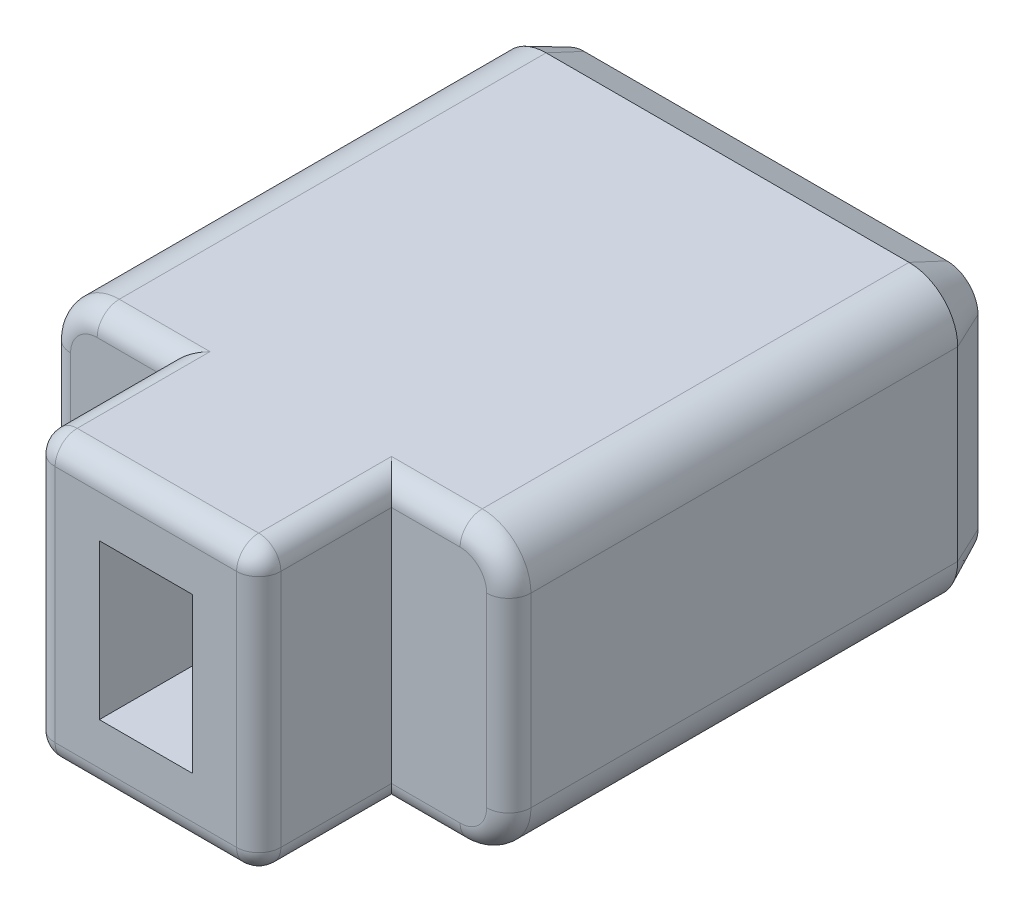
from build123d import *

# Parameters (mm, degrees)
BOSS_EXTRU_1_DEPTH      = 14
ESQUISSE3_W             = 2.1
ESQUISSE3_H             = 3.5
ENL_V_MAT_EXTRU_1_DEPTH = 3
ESQUISSE4_OUTSIDE_W     = 16.116
ESQUISSE4_OUTSIDE_H     = 12.116
ESQUISSE4_OUTSIDE_W_2   = 5.1
ESQUISSE4_OUTSIDE_H_2   = 6.4
ENL_V_MAT_EXTRU_2_DEPTH = 3
CONG_1_R                = 0.5
CHANFREIN1_SIZE         = 0.4
CHANFREIN1_SIZE2        = 0.857802768
ENL_V_MAT_EXTRU_3_DEPTH = 0.3
BOSS_EXTRU_2_DEPTH      = 0.3


with BuildPart() as part:
    # Esquisse2 → Boss.-Extru.1 (new body)
    with BuildSketch(Plane.XY):
        with BuildLine():
            Line((1.1, 0), (9.3, 0))
            ThreePointArc((9.3, 0), (10.077817459, 0.322182541), (10.4, 1.1))
            Line((10.4, 1.1), (10.4, 5.3))
            ThreePointArc((10.4, 5.3), (10.077817459, 6.077817459), (9.3, 6.4))
            Line((9.3, 6.4), (1.1, 6.4))
            ThreePointArc((1.1, 6.4), (0.322182541, 6.077817459), (0, 5.3))
            Line((0, 5.3), (0, 1.1))
            ThreePointArc((0, 1.1), (0.322182541, 0.322182541), (1.1, 0))
        make_face()
    extrude(amount=BOSS_EXTRU_1_DEPTH)

    # Esquisse3 → Enlèv. mat.-Extru.1 (cut)
    with BuildSketch(Plane.XY.offset(14)):
        with Locations((5.2, 3.2)):
            Rectangle(ESQUISSE3_W, ESQUISSE3_H)
    extrude(amount=-ENL_V_MAT_EXTRU_1_DEPTH, mode=Mode.SUBTRACT)

    # Esquisse4 outside → Enlèv. mat.-Extru.2 (cut)
    with BuildSketch(Plane.XY.offset(14)):
        with Locations((5.2, 3.2)):
            Rectangle(ESQUISSE4_OUTSIDE_W, ESQUISSE4_OUTSIDE_H)
        with Locations((5.2, 3.2)):
            Rectangle(ESQUISSE4_OUTSIDE_W_2, ESQUISSE4_OUTSIDE_H_2, mode=Mode.SUBTRACT)
    extrude(amount=-ENL_V_MAT_EXTRU_2_DEPTH, mode=Mode.SUBTRACT)

    # Congé1
    cong_1_edges = [part.edges().sort_by_distance(p)[0] for p in [
        (8.525, 0, 11),
        (10.077817459, 0.322182541, 11),
        (10.4, 3.2, 11),
        (10.077817459, 6.077817459, 11),
        (1.875, 6.4, 11),
        (0.322182541, 6.077817459, 11),
        (1.875, 0, 11),
        (0.322182541, 0.322182541, 11),
        (7.75, 6.4, 12.5),
        (2.65, 6.4, 12.5),
        (7.75, 0, 12.5),
        (2.65, 0, 12.5),
        (2.65, 3.2, 14),
        (5.2, 6.4, 14),
        (7.75, 3.2, 14),
        (5.2, 0, 14),
        (8.525, 6.4, 11),
        (0, 3.2, 11),
    ]]
    fillet(cong_1_edges, radius=CONG_1_R)

    # Chanfrein1
    chanfrein1_edges = [part.edges().sort_by_distance(p)[0] for p in [
        (5.2, 0, 0),
        (10.077817459, 0.322182541, 0),
        (0.322182541, 0.322182541, 0),
        (10.4, 3.2, 0),
        (0, 3.2, 0),
        (10.077817459, 6.077817459, 0),
        (0.322182541, 6.077817459, 0),
        (5.2, 6.4, 0),
    ]]
    chanfrein1_side = [part.faces().sort_by_distance(p)[0] for p in [
        (5.2, 3.2, 0),
    ]]
    chamfer(chanfrein1_edges, length=CHANFREIN1_SIZE, length2=CHANFREIN1_SIZE2, reference=chanfrein1_side[0])

    # Esquisse5 → Enlèv. mat.-Extru.3 (cut)
    with BuildSketch(Plane(origin=(0, 0, 0), x_dir=(-1, 0, 0), z_dir=(0, 0, -1))):
        with BuildLine():
            Line((-4.482051282, 2.223076923), (-4.123076923, 2.223076923))
            add(Edge.make_bspline(
                [(-4.123076923, 2.223076923), (-4.132172802, 2.182879821), (-4.149904355, 2.104519386), (-4.184689712, 1.991513998), (-4.225434495, 1.885765982), (-4.271957447, 1.78691387), (-4.323886866, 1.694871968), (-4.383007257, 1.610659662), (-4.446581457, 1.532228116), (-4.517727797, 1.463096907), (-4.591770568, 1.39996683), (-4.670710111, 1.346640876), (-4.752169587, 1.300230117), (-4.83719503, 1.262457843), (-4.925900563, 1.233638239), (-5.017876741, 1.21280939), (-5.113071631, 1.199496847), (-5.177787354, 1.198126712), (-5.210416667, 1.197435897)],
                knots=[0, 0, 0, 0, 1.213646873, 2.365889363, 3.479226314, 4.54912843, 5.581579656, 6.587705624, 7.576924878, 8.55050232, 9.505464024, 10.439453725, 11.351887816, 12.264152294, 13.174752891, 14.094686289, 15.039351257, 16, 16, 16, 16], degree=3))
            add(Edge.make_bspline(
                [(-5.210416667, 1.197435897), (-5.258094164, 1.199027149), (-5.352644116, 1.202182785), (-5.491403374, 1.230611249), (-5.625136021, 1.275963762), (-5.7524842, 1.338183678), (-5.870766075, 1.415281732), (-5.976128691, 1.506523979), (-6.066425025, 1.611076421), (-6.142330911, 1.726114044), (-6.202133725, 1.848818877), (-6.244814609, 1.975692907), (-6.271762849, 2.105224606), (-6.275198805, 2.192767116), (-6.276923077, 2.236698718)],
                knots=[0, 0, 0, 0, 1.037361841, 2.057207614, 3.07074694, 4.106133614, 5.135440569, 6.137362823, 7.131079132, 8.134553603, 9.130922184, 10.094788979, 11.043904817, 12, 12, 12, 12], degree=3))
            add(Edge.make_bspline(
                [(-6.276923077, 2.236698718), (-6.275539605, 2.278987452), (-6.272833897, 2.361693152), (-6.251540773, 2.482378728), (-6.216237816, 2.596400166), (-6.166137783, 2.703538574), (-6.102114735, 2.804087582), (-6.023690642, 2.897152494), (-5.931612715, 2.984047443), (-5.86169914, 3.033978011), (-5.825801282, 3.059615385)],
                knots=[0, 0, 0, 0, 1.034740432, 2.023681557, 2.989439786, 3.948891607, 4.910213012, 5.898894732, 6.921165452, 8, 8, 8, 8], degree=3))
            add(Edge.make_bspline(
                [(-5.825801282, 3.059615385), (-5.864137499, 3.080191012), (-5.940809934, 3.121342266), (-6.043507734, 3.202018162), (-6.138023166, 3.293734818), (-6.189768342, 3.364866735), (-6.216025641, 3.400961538)],
                knots=[0, 0, 0, 0, 0.994607769, 1.989215539, 2.979658163, 4, 4, 4, 4], degree=3))
            add(Edge.make_bspline(
                [(-6.216025641, 3.400961538), (-6.233356316, 3.427373686), (-6.26787002, 3.479972967), (-6.310391281, 3.563667495), (-6.347879736, 3.649096513), (-6.37822649, 3.736968961), (-6.401497955, 3.827322661), (-6.418276255, 3.919969224), (-6.429147626, 4.015018145), (-6.430226667, 4.079350901), (-6.430769231, 4.111698718)],
                knots=[0, 0, 0, 0, 1.00515716, 2.001751025, 2.984458985, 3.97420733, 4.958128942, 5.952324961, 6.970387383, 8, 8, 8, 8], degree=3))
            add(Edge.make_bspline(
                [(-6.430769231, 4.111698718), (-6.428743989, 4.167663613), (-6.42471183, 4.279086982), (-6.392790373, 4.444008829), (-6.342381333, 4.604955427), (-6.27195412, 4.75956667), (-6.18482671, 4.904129083), (-6.081145827, 5.033094403), (-5.962534477, 5.144582643), (-5.830197653, 5.237360691), (-5.68630887, 5.311534147), (-5.532868345, 5.364666879), (-5.370679404, 5.396859709), (-5.259709965, 5.400639474), (-5.203205128, 5.402564103)],
                knots=[0, 0, 0, 0, 1.014706638, 2.020231274, 3.036313833, 4.068571099, 5.094908553, 6.090824756, 7.060992088, 8.038345228, 9.013581893, 9.988228495, 10.975620497, 12, 12, 12, 12], degree=3))
            add(Edge.make_bspline(
                [(-5.203205128, 5.402564103), (-5.165246363, 5.401570424), (-5.090682463, 5.399618502), (-4.9810235, 5.386317129), (-4.876778256, 5.361480703), (-4.776379933, 5.330186609), (-4.681760311, 5.286956208), (-4.591303684, 5.235671401), (-4.506016772, 5.174294586), (-4.425884157, 5.103608562), (-4.351166433, 5.024051615), (-4.282737635, 4.935670934), (-4.222178503, 4.838072885), (-4.166983575, 4.732595618), (-4.120271063, 4.617488155), (-4.079407489, 4.494143595), (-4.045544141, 4.361842187), (-4.029014069, 4.270204999), (-4.020512821, 4.223076923)],
                knots=[0, 0, 0, 0, 0.990568784, 1.945813299, 2.875676271, 3.783761552, 4.685324092, 5.584377753, 6.493425385, 7.4218245, 8.36851308, 9.337390209, 10.333265409, 11.361963029, 12.440115797, 13.570763079, 14.750668092, 16, 16, 16, 16], degree=3))
            Line((-4.020512821, 4.223076923), (-4.379487179, 4.223076923))
            add(Edge.make_bspline(
                [(-4.379487179, 4.223076923), (-4.387118243, 4.253901726), (-4.401958094, 4.313845598), (-4.429866947, 4.399311139), (-4.45787412, 4.47900565), (-4.490311856, 4.551314604), (-4.524644529, 4.617265759), (-4.561464259, 4.677017538), (-4.601146872, 4.729940781), (-4.630535719, 4.760986514), (-4.644711538, 4.775961538)],
                knots=[0, 0, 0, 0, 1.227409514, 2.386898646, 3.474821375, 4.49196229, 5.448190758, 6.348047463, 7.203174547, 8, 8, 8, 8], degree=3))
            add(Edge.make_bspline(
                [(-4.644711538, 4.775961538), (-4.663625825, 4.793169329), (-4.701087137, 4.827250782), (-4.76262788, 4.8714789), (-4.82763193, 4.909502151), (-4.896789588, 4.939903316), (-4.969627615, 4.963233834), (-5.046089988, 4.979888915), (-5.126502917, 4.990788894), (-5.18153399, 4.991794533), (-5.209615385, 4.992307692)],
                knots=[0, 0, 0, 0, 0.987673777, 1.956169713, 2.922958465, 3.893597884, 4.869766497, 5.874185781, 6.915234169, 8, 8, 8, 8], degree=3))
            add(Edge.make_bspline(
                [(-5.209615385, 4.992307692), (-5.241448955, 4.991621354), (-5.303484394, 4.990283856), (-5.39400022, 4.977425049), (-5.480036376, 4.959232218), (-5.560686962, 4.930153903), (-5.637551649, 4.895417149), (-5.708737853, 4.850964488), (-5.775216799, 4.799002976), (-5.836422077, 4.74018012), (-5.89108324, 4.675557144), (-5.939388385, 4.608069597), (-5.980982451, 4.538169232), (-6.013333239, 4.464646611), (-6.040538243, 4.389136122), (-6.058770549, 4.310341705), (-6.069136276, 4.228963731), (-6.070902137, 4.173960727), (-6.071794872, 4.146153846)],
                knots=[0, 0, 0, 0, 1.131388683, 2.204785482, 3.246441662, 4.252851856, 5.247356788, 6.241181003, 7.22926868, 8.243715995, 9.254465245, 10.235036049, 11.192984918, 12.141087045, 13.087426855, 14.043631555, 15.010953923, 16, 16, 16, 16], degree=3))
            add(Edge.make_bspline(
                [(-6.071794872, 4.146153846), (-6.070425424, 4.108923192), (-6.06770243, 4.034894228), (-6.045263849, 3.925951777), (-6.008784671, 3.820693552), (-5.958785101, 3.720677931), (-5.896401591, 3.62841055), (-5.823392741, 3.547133882), (-5.740422622, 3.477841607), (-5.662765755, 3.43054886), (-5.593787365, 3.398821262), (-5.535204528, 3.377096108), (-5.469607981, 3.359132482), (-5.398017693, 3.342329942), (-5.319417432, 3.327809305), (-5.234365734, 3.316175248), (-5.142449502, 3.306375708), (-5.079025259, 3.302176407), (-5.046153846, 3.3)],
                knots=[0, 0, 0, 0, 1.192805178, 2.371758753, 3.549810072, 4.756155874, 5.946098869, 7.110280517, 8.247279574, 9.400162675, 10.013208869, 10.679725361, 11.400782005, 12.192190353, 13.037020936, 13.96226458, 14.943885823, 16, 16, 16, 16], degree=3))
            Line((-5.046153846, 3.3), (-5.046153846, 2.88974359))
            add(Edge.make_bspline(
                [(-5.046153846, 2.88974359), (-5.088150562, 2.888762199), (-5.170660543, 2.886834082), (-5.291308641, 2.868815079), (-5.406306817, 2.839057635), (-5.513901263, 2.797793619), (-5.611837507, 2.748050326), (-5.697356677, 2.691251666), (-5.767743193, 2.626744832), (-5.823945861, 2.556359146), (-5.865824484, 2.480980159), (-5.89566742, 2.40214926), (-5.91522079, 2.319915292), (-5.917034619, 2.263518126), (-5.917948718, 2.235096154)],
                knots=[0, 0, 0, 0, 1.243616131, 2.44330398, 3.604505843, 4.75669394, 5.850271017, 6.853290421, 7.788562808, 8.667255455, 9.510416964, 10.331949075, 11.159367386, 12, 12, 12, 12], degree=3))
            add(Edge.make_bspline(
                [(-5.917948718, 2.235096154), (-5.91735912, 2.214221522), (-5.916188689, 2.172782552), (-5.906034732, 2.111908452), (-5.891099605, 2.052952656), (-5.869264862, 1.996484401), (-5.840766114, 1.942387341), (-5.80637209, 1.890106875), (-5.764855489, 1.840569584), (-5.7192227, 1.792655284), (-5.667906556, 1.74940941), (-5.612600183, 1.712031857), (-5.554359317, 1.679379127), (-5.492850933, 1.6530839), (-5.42784051, 1.632866221), (-5.359681028, 1.618661468), (-5.288113774, 1.609612794), (-5.239290185, 1.608340381), (-5.214423077, 1.607692308)],
                knots=[0, 0, 0, 0, 0.95422432, 1.894264499, 2.815862866, 3.732507896, 4.656047834, 5.60823639, 6.589073805, 7.608638867, 8.631711616, 9.651715799, 10.65801814, 11.681528505, 12.705549186, 13.767074307, 14.862713597, 16, 16, 16, 16], degree=3))
            add(Edge.make_bspline(
                [(-5.214423077, 1.607692308), (-5.174463142, 1.609275267), (-5.096292971, 1.612371873), (-4.983725649, 1.639891651), (-4.879168109, 1.683156126), (-4.800266567, 1.735429254), (-4.742005947, 1.786360527), (-4.699530846, 1.830715578), (-4.658184177, 1.880805783), (-4.619294171, 1.937517388), (-4.582737756, 2.0006376), (-4.546195196, 2.068600834), (-4.512748799, 2.143503144), (-4.492494915, 2.196005048), (-4.482051282, 2.223076923)],
                knots=[0, 0, 0, 0, 1.395667895, 2.730224622, 4.027984045, 5.336391174, 6.018318975, 6.731826814, 7.481767641, 8.28762907, 9.133535766, 10.031970229, 10.985212891, 12, 12, 12, 12], degree=3))
        make_face()
    extrude(amount=-ENL_V_MAT_EXTRU_3_DEPTH, mode=Mode.SUBTRACT)


with BuildPart() as body_2:
    # Esquisse5<2> → Boss.-Extru.2 (new body)
    with BuildSketch(Plane(origin=(0, 0, 0), x_dir=(-1, 0, 0), z_dir=(0, 0, -1))):
        with BuildLine():
            Line((-4.482051282, 2.223076923), (-4.123076923, 2.223076923))
            add(Edge.make_bspline(
                [(-4.123076923, 2.223076923), (-4.132172802, 2.182879821), (-4.149904355, 2.104519386), (-4.184689712, 1.991513998), (-4.225434495, 1.885765982), (-4.271957447, 1.78691387), (-4.323886866, 1.694871968), (-4.383007257, 1.610659662), (-4.446581457, 1.532228116), (-4.517727797, 1.463096907), (-4.591770568, 1.39996683), (-4.670710111, 1.346640876), (-4.752169587, 1.300230117), (-4.83719503, 1.262457843), (-4.925900563, 1.233638239), (-5.017876741, 1.21280939), (-5.113071631, 1.199496847), (-5.177787354, 1.198126712), (-5.210416667, 1.197435897)],
                knots=[0, 0, 0, 0, 1.213646873, 2.365889363, 3.479226314, 4.54912843, 5.581579656, 6.587705624, 7.576924878, 8.55050232, 9.505464024, 10.439453725, 11.351887816, 12.264152294, 13.174752891, 14.094686289, 15.039351257, 16, 16, 16, 16], degree=3))
            add(Edge.make_bspline(
                [(-5.210416667, 1.197435897), (-5.258094164, 1.199027149), (-5.352644116, 1.202182785), (-5.491403374, 1.230611249), (-5.625136021, 1.275963762), (-5.7524842, 1.338183678), (-5.870766075, 1.415281732), (-5.976128691, 1.506523979), (-6.066425025, 1.611076421), (-6.142330911, 1.726114044), (-6.202133725, 1.848818877), (-6.244814609, 1.975692907), (-6.271762849, 2.105224606), (-6.275198805, 2.192767116), (-6.276923077, 2.236698718)],
                knots=[0, 0, 0, 0, 1.037361841, 2.057207614, 3.07074694, 4.106133614, 5.135440569, 6.137362823, 7.131079132, 8.134553603, 9.130922184, 10.094788979, 11.043904817, 12, 12, 12, 12], degree=3))
            add(Edge.make_bspline(
                [(-6.276923077, 2.236698718), (-6.275539605, 2.278987452), (-6.272833897, 2.361693152), (-6.251540773, 2.482378728), (-6.216237816, 2.596400166), (-6.166137783, 2.703538574), (-6.102114735, 2.804087582), (-6.023690642, 2.897152494), (-5.931612715, 2.984047443), (-5.86169914, 3.033978011), (-5.825801282, 3.059615385)],
                knots=[0, 0, 0, 0, 1.034740432, 2.023681557, 2.989439786, 3.948891607, 4.910213012, 5.898894732, 6.921165452, 8, 8, 8, 8], degree=3))
            add(Edge.make_bspline(
                [(-5.825801282, 3.059615385), (-5.864137499, 3.080191012), (-5.940809934, 3.121342266), (-6.043507734, 3.202018162), (-6.138023166, 3.293734818), (-6.189768342, 3.364866735), (-6.216025641, 3.400961538)],
                knots=[0, 0, 0, 0, 0.994607769, 1.989215539, 2.979658163, 4, 4, 4, 4], degree=3))
            add(Edge.make_bspline(
                [(-6.216025641, 3.400961538), (-6.233356316, 3.427373686), (-6.26787002, 3.479972967), (-6.310391281, 3.563667495), (-6.347879736, 3.649096513), (-6.37822649, 3.736968961), (-6.401497955, 3.827322661), (-6.418276255, 3.919969224), (-6.429147626, 4.015018145), (-6.430226667, 4.079350901), (-6.430769231, 4.111698718)],
                knots=[0, 0, 0, 0, 1.00515716, 2.001751025, 2.984458985, 3.97420733, 4.958128942, 5.952324961, 6.970387383, 8, 8, 8, 8], degree=3))
            add(Edge.make_bspline(
                [(-6.430769231, 4.111698718), (-6.428743989, 4.167663613), (-6.42471183, 4.279086982), (-6.392790373, 4.444008829), (-6.342381333, 4.604955427), (-6.27195412, 4.75956667), (-6.18482671, 4.904129083), (-6.081145827, 5.033094403), (-5.962534477, 5.144582643), (-5.830197653, 5.237360691), (-5.68630887, 5.311534147), (-5.532868345, 5.364666879), (-5.370679404, 5.396859709), (-5.259709965, 5.400639474), (-5.203205128, 5.402564103)],
                knots=[0, 0, 0, 0, 1.014706638, 2.020231274, 3.036313833, 4.068571099, 5.094908553, 6.090824756, 7.060992088, 8.038345228, 9.013581893, 9.988228495, 10.975620497, 12, 12, 12, 12], degree=3))
            add(Edge.make_bspline(
                [(-5.203205128, 5.402564103), (-5.165246363, 5.401570424), (-5.090682463, 5.399618502), (-4.9810235, 5.386317129), (-4.876778256, 5.361480703), (-4.776379933, 5.330186609), (-4.681760311, 5.286956208), (-4.591303684, 5.235671401), (-4.506016772, 5.174294586), (-4.425884157, 5.103608562), (-4.351166433, 5.024051615), (-4.282737635, 4.935670934), (-4.222178503, 4.838072885), (-4.166983575, 4.732595618), (-4.120271063, 4.617488155), (-4.079407489, 4.494143595), (-4.045544141, 4.361842187), (-4.029014069, 4.270204999), (-4.020512821, 4.223076923)],
                knots=[0, 0, 0, 0, 0.990568784, 1.945813299, 2.875676271, 3.783761552, 4.685324092, 5.584377753, 6.493425385, 7.4218245, 8.36851308, 9.337390209, 10.333265409, 11.361963029, 12.440115797, 13.570763079, 14.750668092, 16, 16, 16, 16], degree=3))
            Line((-4.020512821, 4.223076923), (-4.379487179, 4.223076923))
            add(Edge.make_bspline(
                [(-4.379487179, 4.223076923), (-4.387118243, 4.253901726), (-4.401958094, 4.313845598), (-4.429866947, 4.399311139), (-4.45787412, 4.47900565), (-4.490311856, 4.551314604), (-4.524644529, 4.617265759), (-4.561464259, 4.677017538), (-4.601146872, 4.729940781), (-4.630535719, 4.760986514), (-4.644711538, 4.775961538)],
                knots=[0, 0, 0, 0, 1.227409514, 2.386898646, 3.474821375, 4.49196229, 5.448190758, 6.348047463, 7.203174547, 8, 8, 8, 8], degree=3))
            add(Edge.make_bspline(
                [(-4.644711538, 4.775961538), (-4.663625825, 4.793169329), (-4.701087137, 4.827250782), (-4.76262788, 4.8714789), (-4.82763193, 4.909502151), (-4.896789588, 4.939903316), (-4.969627615, 4.963233834), (-5.046089988, 4.979888915), (-5.126502917, 4.990788894), (-5.18153399, 4.991794533), (-5.209615385, 4.992307692)],
                knots=[0, 0, 0, 0, 0.987673777, 1.956169713, 2.922958465, 3.893597884, 4.869766497, 5.874185781, 6.915234169, 8, 8, 8, 8], degree=3))
            add(Edge.make_bspline(
                [(-5.209615385, 4.992307692), (-5.241448955, 4.991621354), (-5.303484394, 4.990283856), (-5.39400022, 4.977425049), (-5.480036376, 4.959232218), (-5.560686962, 4.930153903), (-5.637551649, 4.895417149), (-5.708737853, 4.850964488), (-5.775216799, 4.799002976), (-5.836422077, 4.74018012), (-5.89108324, 4.675557144), (-5.939388385, 4.608069597), (-5.980982451, 4.538169232), (-6.013333239, 4.464646611), (-6.040538243, 4.389136122), (-6.058770549, 4.310341705), (-6.069136276, 4.228963731), (-6.070902137, 4.173960727), (-6.071794872, 4.146153846)],
                knots=[0, 0, 0, 0, 1.131388683, 2.204785482, 3.246441662, 4.252851856, 5.247356788, 6.241181003, 7.22926868, 8.243715995, 9.254465245, 10.235036049, 11.192984918, 12.141087045, 13.087426855, 14.043631555, 15.010953923, 16, 16, 16, 16], degree=3))
            add(Edge.make_bspline(
                [(-6.071794872, 4.146153846), (-6.070425424, 4.108923192), (-6.06770243, 4.034894228), (-6.045263849, 3.925951777), (-6.008784671, 3.820693552), (-5.958785101, 3.720677931), (-5.896401591, 3.62841055), (-5.823392741, 3.547133882), (-5.740422622, 3.477841607), (-5.662765755, 3.43054886), (-5.593787365, 3.398821262), (-5.535204528, 3.377096108), (-5.469607981, 3.359132482), (-5.398017693, 3.342329942), (-5.319417432, 3.327809305), (-5.234365734, 3.316175248), (-5.142449502, 3.306375708), (-5.079025259, 3.302176407), (-5.046153846, 3.3)],
                knots=[0, 0, 0, 0, 1.192805178, 2.371758753, 3.549810072, 4.756155874, 5.946098869, 7.110280517, 8.247279574, 9.400162675, 10.013208869, 10.679725361, 11.400782005, 12.192190353, 13.037020936, 13.96226458, 14.943885823, 16, 16, 16, 16], degree=3))
            Line((-5.046153846, 3.3), (-5.046153846, 2.88974359))
            add(Edge.make_bspline(
                [(-5.046153846, 2.88974359), (-5.088150562, 2.888762199), (-5.170660543, 2.886834082), (-5.291308641, 2.868815079), (-5.406306817, 2.839057635), (-5.513901263, 2.797793619), (-5.611837507, 2.748050326), (-5.697356677, 2.691251666), (-5.767743193, 2.626744832), (-5.823945861, 2.556359146), (-5.865824484, 2.480980159), (-5.89566742, 2.40214926), (-5.91522079, 2.319915292), (-5.917034619, 2.263518126), (-5.917948718, 2.235096154)],
                knots=[0, 0, 0, 0, 1.243616131, 2.44330398, 3.604505843, 4.75669394, 5.850271017, 6.853290421, 7.788562808, 8.667255455, 9.510416964, 10.331949075, 11.159367386, 12, 12, 12, 12], degree=3))
            add(Edge.make_bspline(
                [(-5.917948718, 2.235096154), (-5.91735912, 2.214221522), (-5.916188689, 2.172782552), (-5.906034732, 2.111908452), (-5.891099605, 2.052952656), (-5.869264862, 1.996484401), (-5.840766114, 1.942387341), (-5.80637209, 1.890106875), (-5.764855489, 1.840569584), (-5.7192227, 1.792655284), (-5.667906556, 1.74940941), (-5.612600183, 1.712031857), (-5.554359317, 1.679379127), (-5.492850933, 1.6530839), (-5.42784051, 1.632866221), (-5.359681028, 1.618661468), (-5.288113774, 1.609612794), (-5.239290185, 1.608340381), (-5.214423077, 1.607692308)],
                knots=[0, 0, 0, 0, 0.95422432, 1.894264499, 2.815862866, 3.732507896, 4.656047834, 5.60823639, 6.589073805, 7.608638867, 8.631711616, 9.651715799, 10.65801814, 11.681528505, 12.705549186, 13.767074307, 14.862713597, 16, 16, 16, 16], degree=3))
            add(Edge.make_bspline(
                [(-5.214423077, 1.607692308), (-5.174463142, 1.609275267), (-5.096292971, 1.612371873), (-4.983725649, 1.639891651), (-4.879168109, 1.683156126), (-4.800266567, 1.735429254), (-4.742005947, 1.786360527), (-4.699530846, 1.830715578), (-4.658184177, 1.880805783), (-4.619294171, 1.937517388), (-4.582737756, 2.0006376), (-4.546195196, 2.068600834), (-4.512748799, 2.143503144), (-4.492494915, 2.196005048), (-4.482051282, 2.223076923)],
                knots=[0, 0, 0, 0, 1.395667895, 2.730224622, 4.027984045, 5.336391174, 6.018318975, 6.731826814, 7.481767641, 8.28762907, 9.133535766, 10.031970229, 10.985212891, 12, 12, 12, 12], degree=3))
        make_face()
    extrude(amount=BOSS_EXTRU_2_DEPTH)


solid = Compound([part.part, body_2.part])
